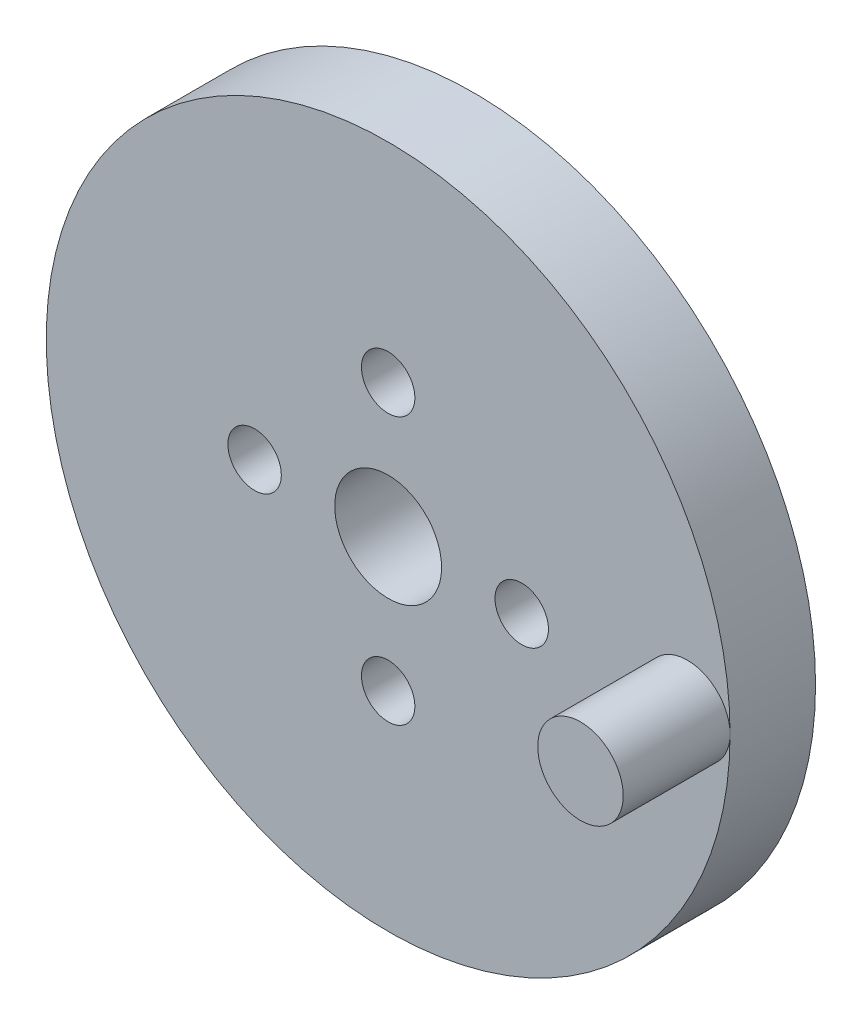
from build123d import *

# Parameters (mm, degrees)
CROQUIS1_R              = 32
CROQUIS1_R_2            = 5
SALIENTE_EXTRUIR1_DEPTH = 8
CROQUIS3_R              = 2.5
CORTAR_EXTRUIR1_DEPTH   = 10
CROQUIS4_R              = 4
SALIENTE_EXTRUIR2_DEPTH = 10


with BuildPart() as part:
    # Croquis1 → Saliente-Extruir1 (new body)
    with BuildSketch(Plane.XY):
        Circle(CROQUIS1_R)
        Circle(CROQUIS1_R_2, mode=Mode.SUBTRACT)
    extrude(amount=SALIENTE_EXTRUIR1_DEPTH)

    # Croquis3 → Cortar-Extruir1 (cut)
    with BuildSketch(Plane(origin=(0, 0, 0), x_dir=(-1, 0, 0), z_dir=(0, 0, -1))):
        with Locations((12.5, 0)):
            Circle(CROQUIS3_R)
        with Locations((0, -12.5)):
            Circle(CROQUIS3_R)
        with Locations((-12.5, 0)):
            Circle(CROQUIS3_R)
        with Locations((0, 12.5)):
            Circle(CROQUIS3_R)
    extrude(amount=-CORTAR_EXTRUIR1_DEPTH, mode=Mode.SUBTRACT)

    # Croquis4 → Saliente-Extruir2 (add)
    with BuildSketch(Plane.XY.offset(8)):
        with Locations((28, 0)):
            Circle(CROQUIS4_R)
    extrude(amount=SALIENTE_EXTRUIR2_DEPTH)


solid = part.part
